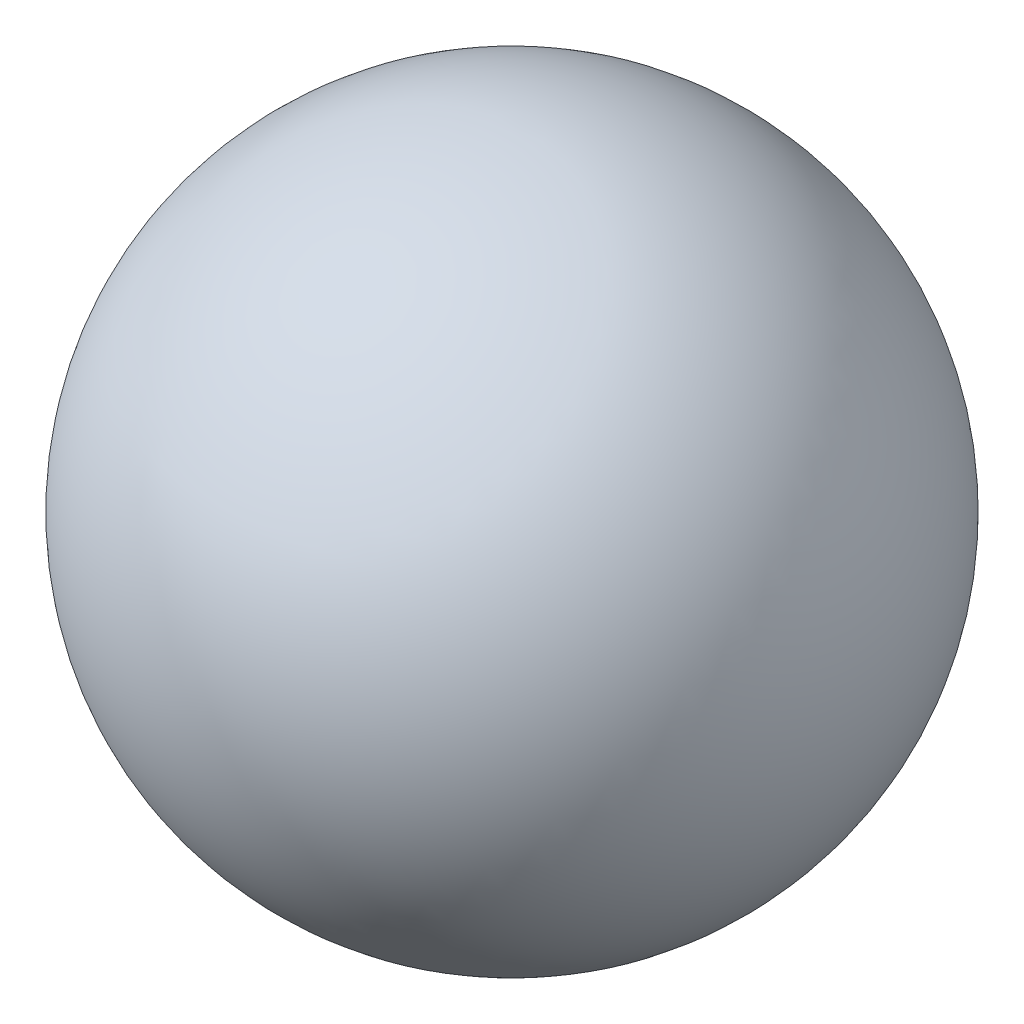
from build123d import *


with BuildPart() as part:
    # 草图1 → 旋转1 (revolve)
    with BuildSketch(Plane.XY):
        with BuildLine():
            Line((0, -21), (0, 21))
            ThreePointArc((0, 21), (21, 0), (0, -21))
        make_face()
    revolve(axis=Axis((0, -21, 0), (0, 1, 0)))


solid = part.part
